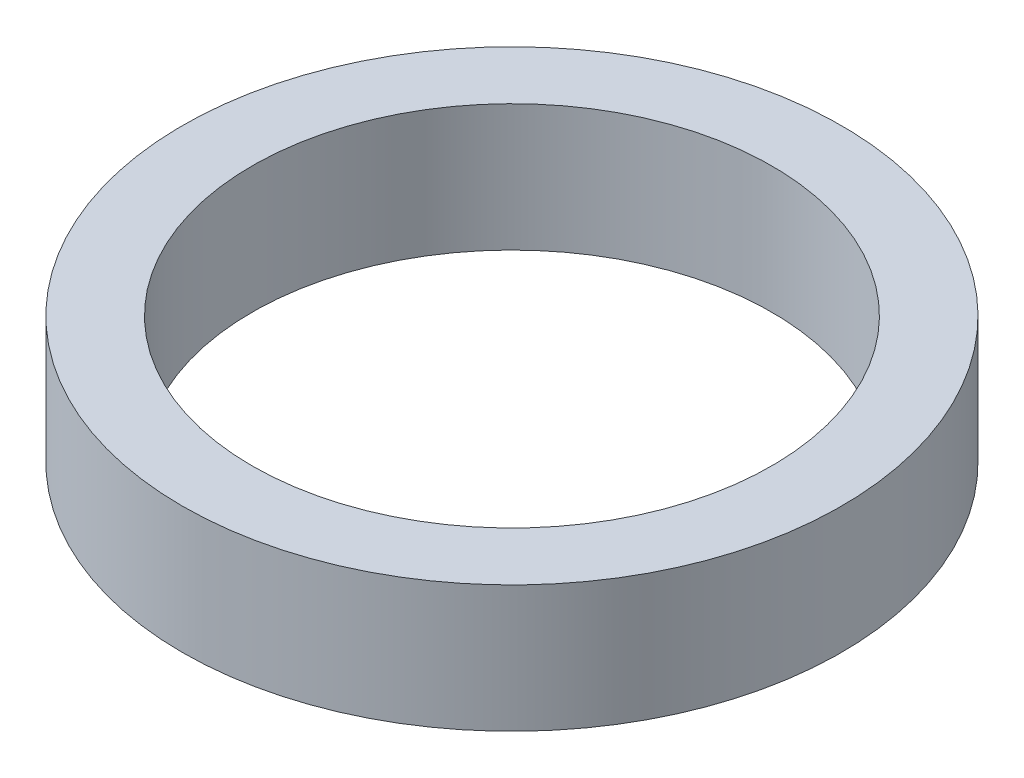
from build123d import *

# Parameters (mm, degrees)
SKETCH_1_R      = 2.6
SKETCH_1_R_2    = 2.05
EXTRUDE_1_DEPTH = 1


with BuildPart() as part:
    # 草图1 → 凸台-拉伸1 (new body)
    with BuildSketch(Plane(origin=(0, 0, 0), x_dir=(1, 0, 0), z_dir=(0, 1, 0))):
        with Locations(Location((0, 0, 0), (0, 0, 270))):
            Circle(SKETCH_1_R)
        with Locations(Location((0, 0, 0), (0, 0, 270))):
            Circle(SKETCH_1_R_2, mode=Mode.SUBTRACT)
    extrude(amount=EXTRUDE_1_DEPTH)


solid = part.part
